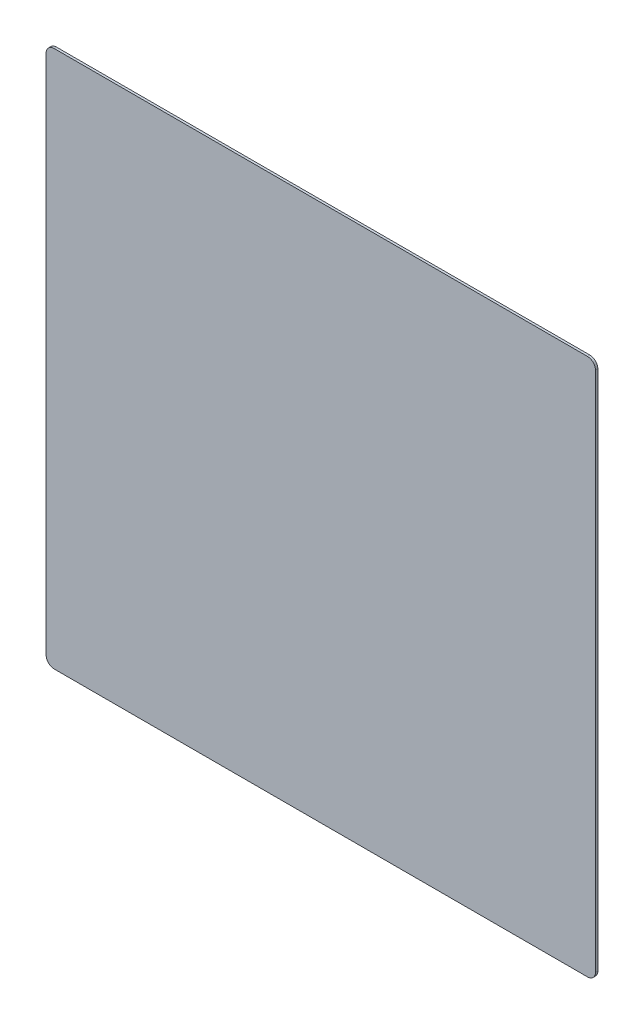
from build123d import *

# Parameters (mm, degrees)
SKETCH_1_W      = 690
SKETCH_1_H      = 675
EXTRUDE_1_DEPTH = 3
FILLET_1_R      = 10


with BuildPart() as part:
    # 草图1 → 凸台-拉伸1 (new body)
    with BuildSketch(Plane.XY):
        Rectangle(SKETCH_1_W, SKETCH_1_H)
    extrude(amount=EXTRUDE_1_DEPTH)

    # 圆角1
    fillet_1_edges = [part.edges().sort_by_distance(p)[0] for p in [
        (345, -337.5, 1.5),
        (-345, -337.5, 1.5),
        (-345, 337.5, 1.5),
        (345, 337.5, 1.5),
    ]]
    fillet(fillet_1_edges, radius=FILLET_1_R)


solid = part.part
